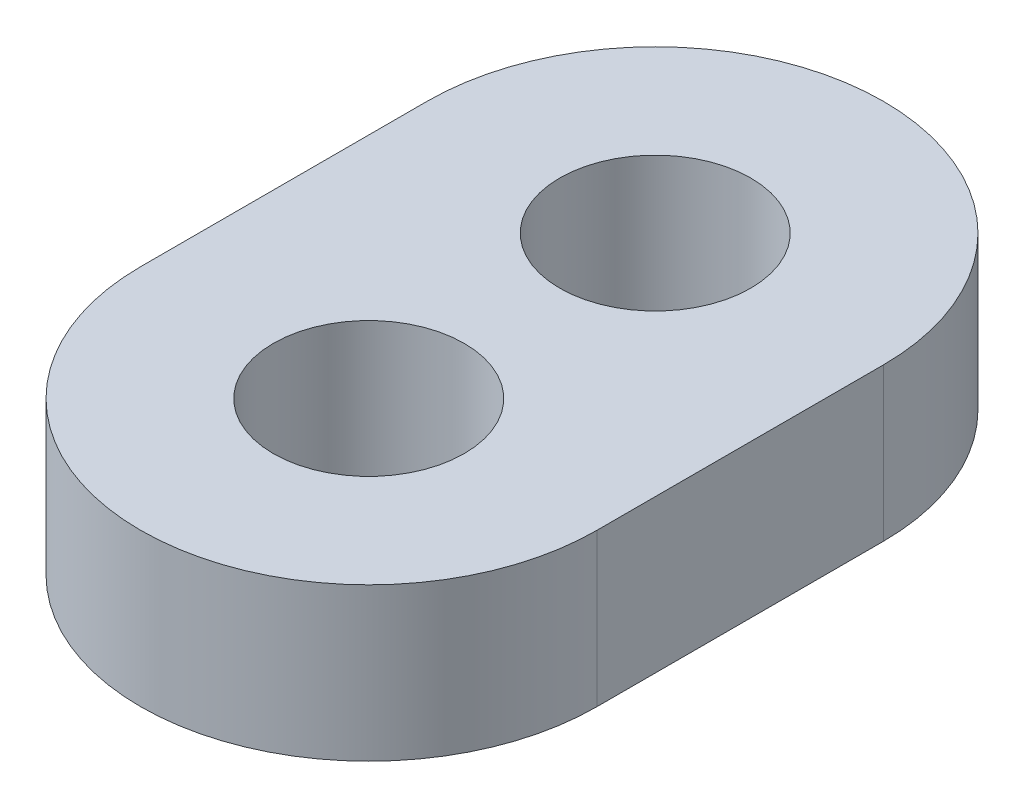
from build123d import *

# Parameters (mm, degrees)
SKIZZE16_R                      = 2.5
AUFSATZ_LINEAR_AUSTRAGEN1_DEPTH = 4


with BuildPart() as part:
    # Skizze16 → Aufsatz-Linear austragen1 (new body)
    with BuildSketch(Plane.XZ.offset(5)):
        with BuildLine():
            Line((5.975062847, -6.5), (5.975062847, -14))
            ThreePointArc((5.975062847, -14), (0, -19.975062847), (-5.975062847, -14))
            Line((-5.975062847, -14), (-5.975062847, -6.5))
            ThreePointArc((-5.975062847, -6.5), (0, -0.524937153), (5.975062847, -6.5))
        make_face()
        with Locations(Location((0, -14, 0), (0, 0, 270))):
            Circle(SKIZZE16_R, mode=Mode.SUBTRACT)
        with Locations(Location((0, -6.5, 0), (0, 0, 270))):
            Circle(SKIZZE16_R, mode=Mode.SUBTRACT)
    extrude(amount=AUFSATZ_LINEAR_AUSTRAGEN1_DEPTH)


solid = part.part
